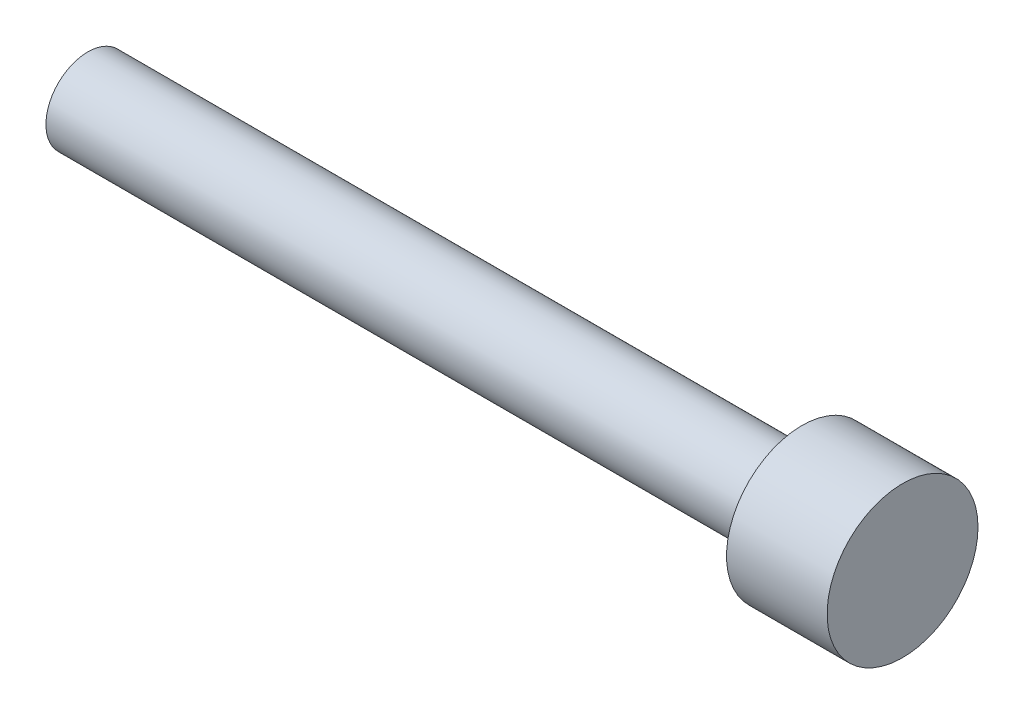
from build123d import *

# Parameters (mm, degrees)
SKETCH1_R           = 1.25
BOSS_EXTRUDE1_DEPTH = 10.65
SKETCH2_R           = 2.25
BOSS_EXTRUDE2_DEPTH = 3


with BuildPart() as part:
    # Sketch1 → Boss-Extrude1 (new, symmetric)
    with BuildSketch(Plane(origin=(0, 0, 0), x_dir=(0, 0, -1), z_dir=(1, 0, 0))):
        Circle(SKETCH1_R)
    extrude(amount=BOSS_EXTRUDE1_DEPTH, both=True)

    # Sketch2 → Boss-Extrude2 (add)
    with BuildSketch(Plane(origin=(10.65, 0, 0), x_dir=(0, 0, -1), z_dir=(1, 0, 0))):
        Circle(SKETCH2_R)
    extrude(amount=BOSS_EXTRUDE2_DEPTH)


solid = part.part
